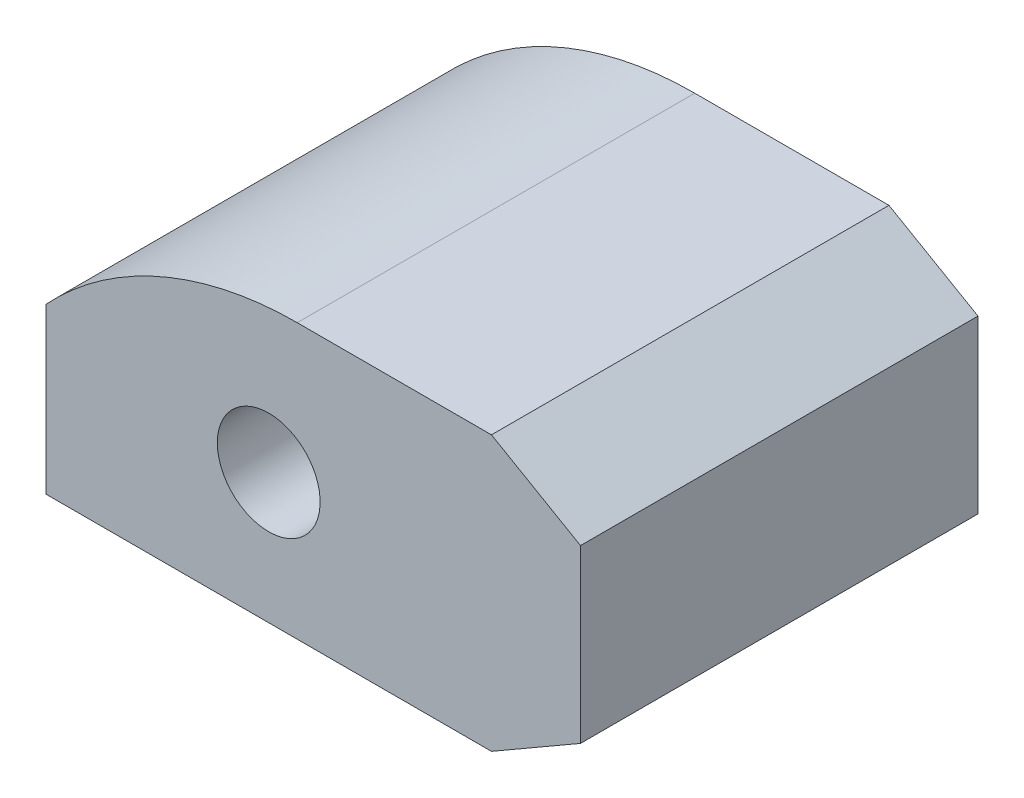
from build123d import *

# Parameters (mm, degrees)
SKETCH1_R           = 7.5
BOSS_EXTRUDE1_DEPTH = 58


with BuildPart() as part:
    # Sketch1 → Boss-Extrude1 (new body)
    with BuildSketch(Plane.XY):
        with BuildLine():
            Line((32.5, -19), (-32.5, -19))
            Line((-32.5, -19), (-32.5, 5))
            ThreePointArc((-32.5, 5), (-15.83939444, 16.82575695), (4.16060556, 21))
            Line((4.16060556, 21), (32.5, 21))
            Line((32.5, 21), (45.490381057, 13.5))
            Line((45.490381057, 13.5), (45.490381057, -11.5))
            Line((45.490381057, -11.5), (32.5, -19))
        make_face()
        with Locations(Location((0, 0, 0), (0, 0, 180))):
            Circle(SKETCH1_R, mode=Mode.SUBTRACT)
    extrude(amount=BOSS_EXTRUDE1_DEPTH)


solid = part.part
